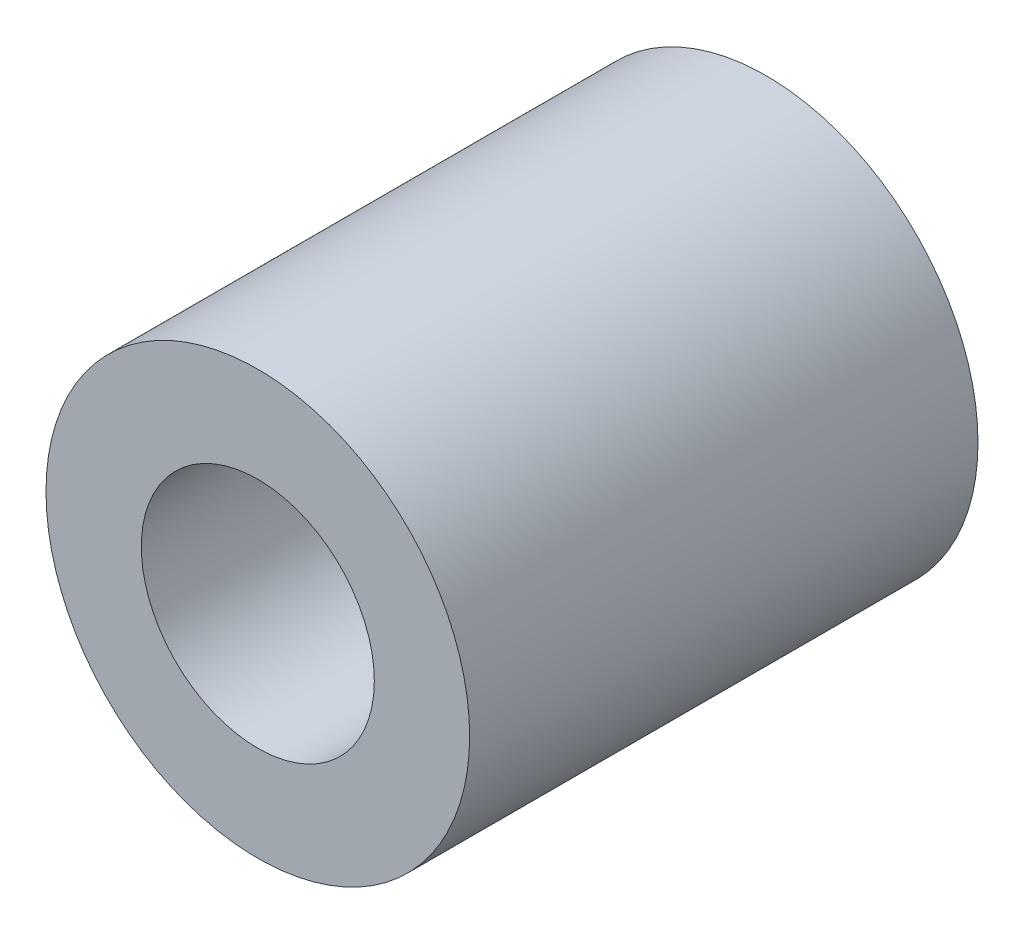
from build123d import *

# Parameters (mm, degrees)
SKETCH1_R           = 5
SKETCH1_R_2         = 2.75
BOSS_EXTRUDE1_DEPTH = 12


with BuildPart() as part:
    # Sketch1 → Boss-Extrude1 (new body)
    with BuildSketch(Plane.XY):
        Circle(SKETCH1_R)
        Circle(SKETCH1_R_2, mode=Mode.SUBTRACT)
    extrude(amount=BOSS_EXTRUDE1_DEPTH)


solid = part.part
